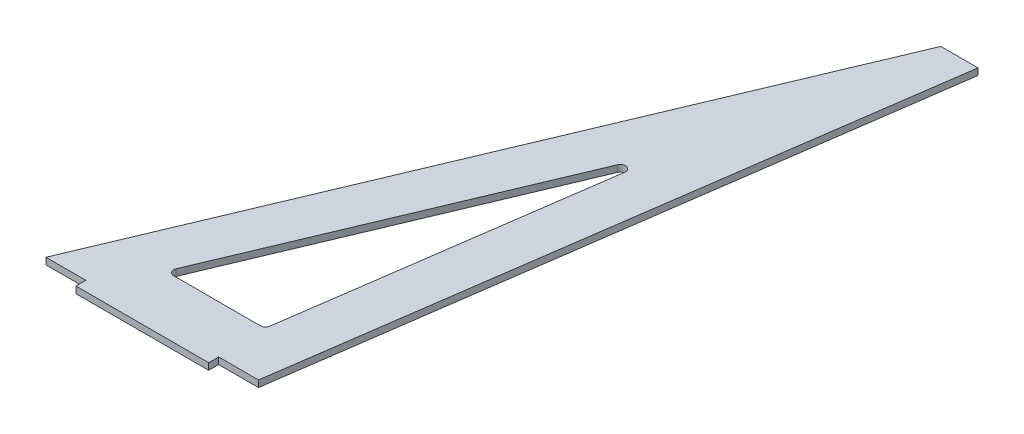
from build123d import *

# Parameters (mm, degrees)
BOSS_EXTRUDE1_DEPTH = 3.175
CUT_EXTRUDE1_REACH  = 336.078
FILLET1_R           = 2.54
SKETCH3_W           = 63.5
SKETCH3_H           = 3.175
BOSS_EXTRUDE2_DEPTH = 4.7625


with BuildPart() as part:
    # Sketch1 → Boss-Extrude1 (new body)
    with BuildSketch(Plane(origin=(0, 0, 0), x_dir=(1, 0, 0), z_dir=(0, 1, 0))):
        Polygon((0, 301.244), (-42.794923706, 0), (-144.394923706, 0), (-17.78, 301.244), align=None)
    extrude(amount=BOSS_EXTRUDE1_DEPTH)

    # Sketch2 → Cut-Extrude1 (cut, up to next)
    with BuildSketch(Plane(origin=(0, 3.175, 0), x_dir=(1, 0, 0), z_dir=(0, 1, 0)), mode=Mode.PRIVATE) as cut_extrude1_sk1:
        Polygon((-38.460690081, 193.042545844), (-109.989583795, 22.86), (-62.636936132, 22.86), align=None)
    cut_extrude1_tool1 = extrude(cut_extrude1_sk1.sketch, amount=-CUT_EXTRUDE1_REACH, mode=Mode.PRIVATE) & part.part
    add(cut_extrude1_tool1.solids().sort_by_distance((-70.362403, 3.175, -79.587515))[0], mode=Mode.SUBTRACT)

    # Fillet1
    fillet1_edges = [part.edges().sort_by_distance(p)[0] for p in [
        (-38.460690081, 1.5875, -193.042545844),
        (-62.636936132, 1.5875, -22.86),
        (-109.989583795, 1.5875, -22.86),
    ]]
    fillet(fillet1_edges, radius=FILLET1_R)

    # Sketch3 → Boss-Extrude2 (add)
    with BuildSketch(Plane.XY):
        with Locations((-93.594923706, 1.5875)):
            Rectangle(SKETCH3_W, SKETCH3_H)
    extrude(amount=BOSS_EXTRUDE2_DEPTH)


solid = part.part
